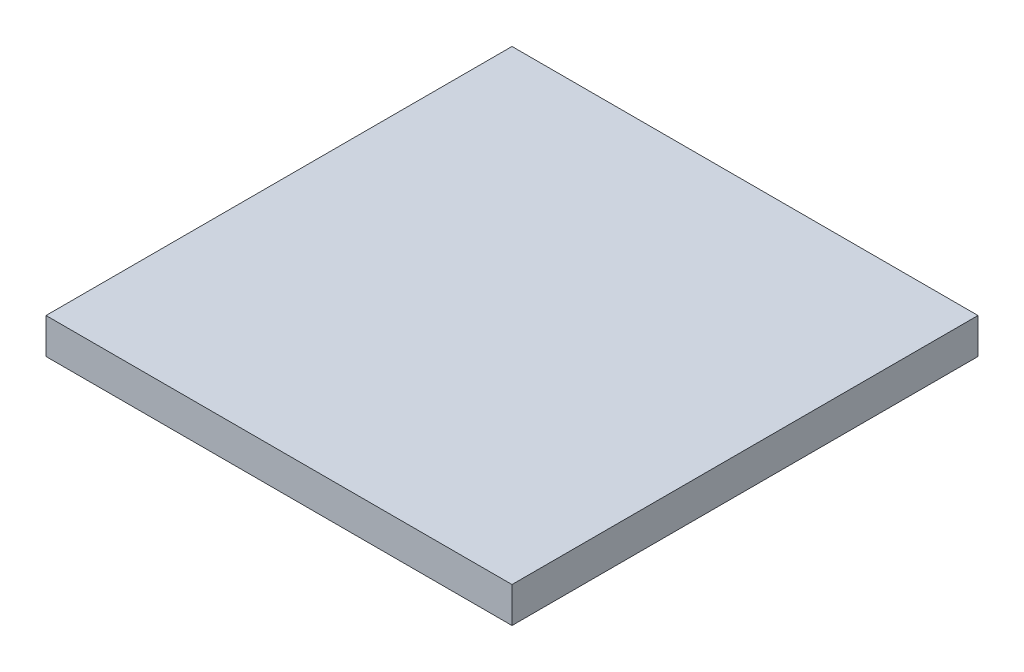
from build123d import *

# Parameters (mm, degrees)
SKETCH1_W           = 40
SKETCH1_H           = 40
BOSS_EXTRUDE1_DEPTH = 3.05


with BuildPart() as part:
    # Sketch1 → Boss-Extrude1 (new body)
    with BuildSketch(Plane(origin=(0, 0, 0), x_dir=(1, 0, 0), z_dir=(0, 1, 0))):
        with Locations((20, 20)):
            Rectangle(SKETCH1_W, SKETCH1_H)
    extrude(amount=BOSS_EXTRUDE1_DEPTH)


solid = part.part
